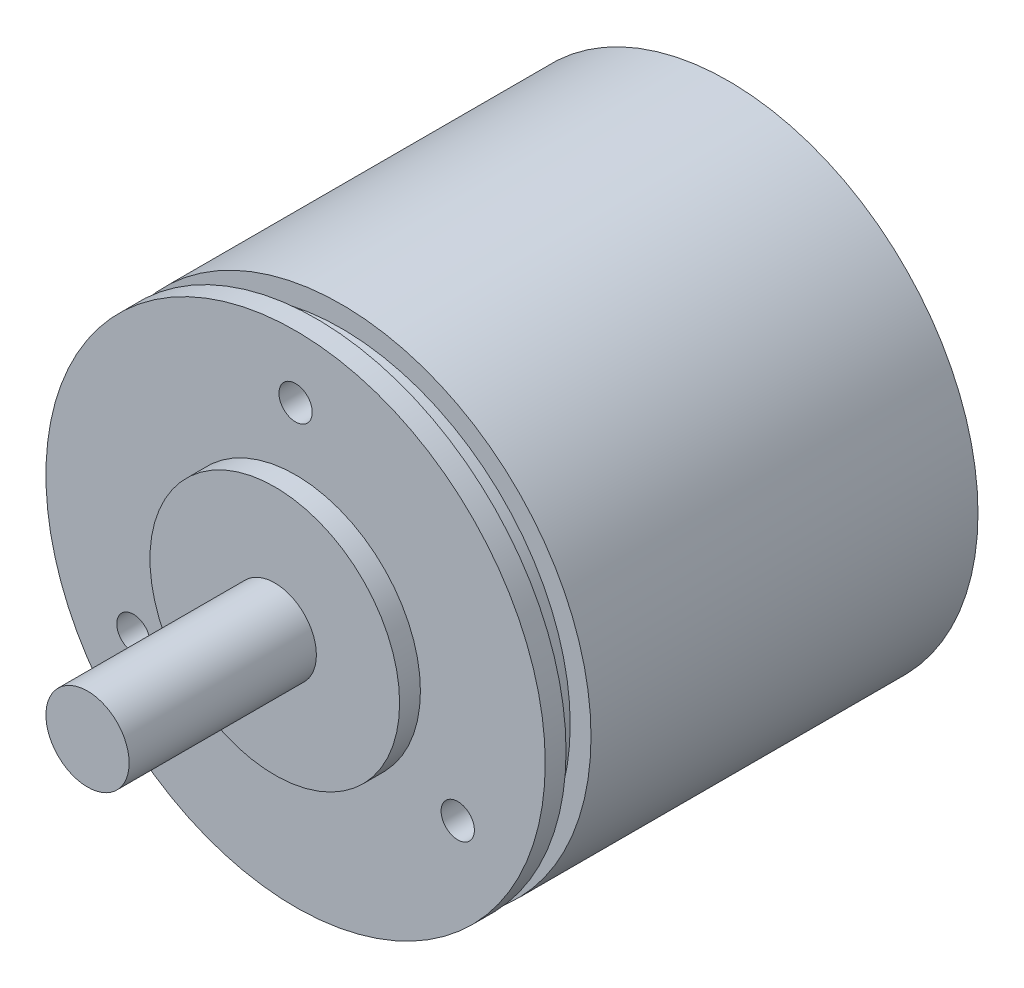
from build123d import *

# Parameters (mm, degrees)
TROU_TARAUD_M2X0_41_D     = 1.6
TROU_TARAUD_M2X0_41_DEPTH = 3.2
TROU_TARAUD_M2X0_41_TIP   = 0.480688495


with BuildPart() as part:
    # Esquisse1 → Révolution1 (revolve)
    with BuildSketch(Plane(origin=(0, 0, 0), x_dir=(0, 0, -1), z_dir=(1, 0, 0))):
        Polygon((-9, 0), (-9, 2), (0, 2), (0, 6), (1, 6), (1, 12), (2, 12), (2, 11), (3.2, 11), (3.2, 12), (21.8, 12), (21.8, 0), align=None)
    revolve(axis=Axis((0, 0, 27.833895637), (0, 0, -1)))

    # Trou taraudé M2x0.41
    with Locations(Plane.XY):
        with Locations((-7.794228634, -4.5), (7.794228634, -4.5), (0, 9)):
            Hole(TROU_TARAUD_M2X0_41_D / 2, depth=TROU_TARAUD_M2X0_41_DEPTH)
            with Locations((0, 0, -(TROU_TARAUD_M2X0_41_DEPTH + TROU_TARAUD_M2X0_41_TIP / 2))):  # 118° drill point
                Cone(0, TROU_TARAUD_M2X0_41_D / 2, TROU_TARAUD_M2X0_41_TIP, mode=Mode.SUBTRACT)


solid = part.part
